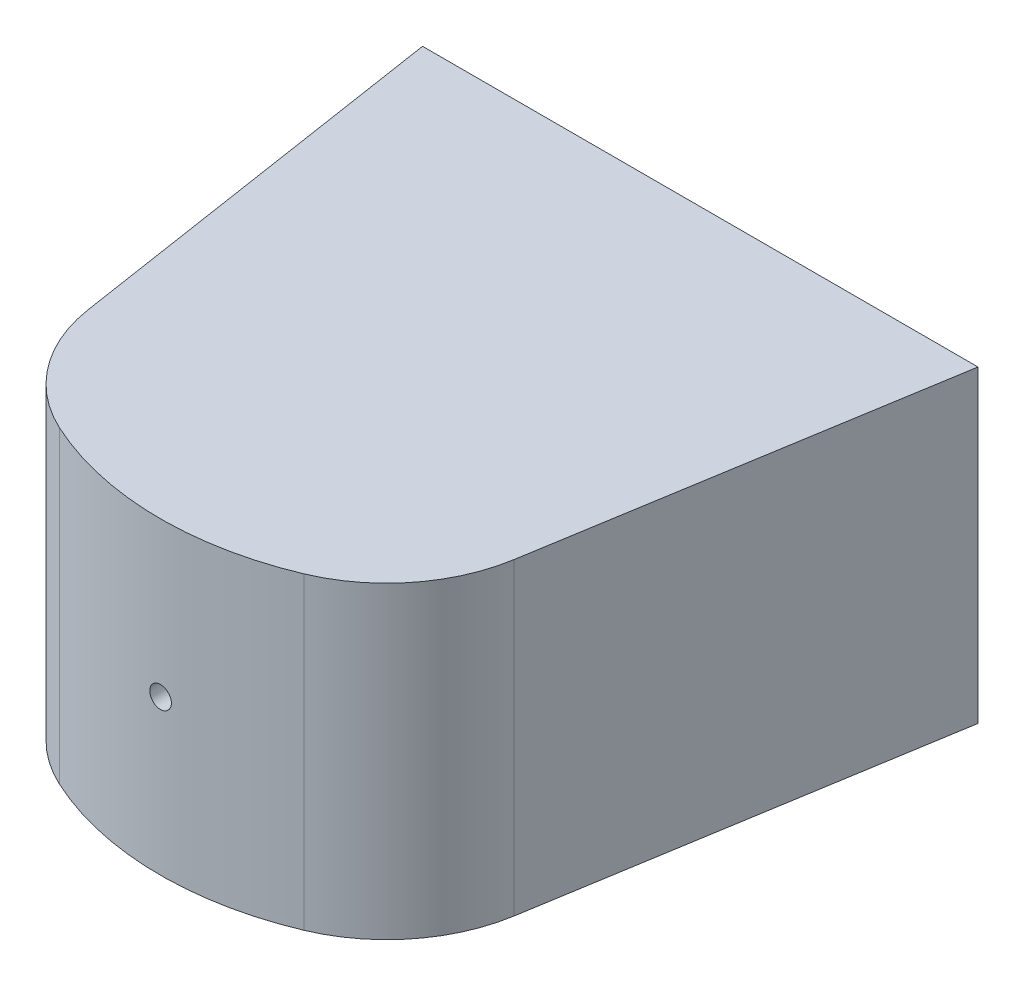
from build123d import *

# Parameters (mm, degrees)
SKETCH1_W               = 40
SKETCH1_H               = 20
BOSS_EXTRUDE1_DEPTH     = 35
FILLET1_RADIUS          = 20
FILLET1_LENGTH          = 20
CUT_EXTRUDE1_DEPTH      = 42.533119315
CUT_EXTRUDE1_DEPTH_BACK = 42.533119315
CUT_EXTRUDE2_DEPTH      = 42.533119315
CUT_EXTRUDE2_DEPTH_BACK = 42.533119315
FILLET2_R               = 10
FILLET3_R               = 10
SKETCH7_R               = 0.7
CUT_EXTRUDE3_DEPTH      = 35
SKETCH10_R              = 0.5
CUT_EXTRUDE4_DEPTH      = 5


with BuildPart() as part:
    # Sketch1 → Boss-Extrude1 (new body)
    with BuildSketch(Plane.XY):
        Rectangle(SKETCH1_W, SKETCH1_H)
    extrude(amount=BOSS_EXTRUDE1_DEPTH)

    # Fillet1: full round fillet: the end face becomes a half cylinder, R = half its width
    fillet1_face = Plane((0, 0, 35), x_dir=(0, -1, 0), z_dir=(0, 0, 1))  # on the end face: x along it, z out of the body
    fillet1_slab = fillet1_face.offset(-FILLET1_RADIUS / 2) * Box(FILLET1_LENGTH, 2 * FILLET1_RADIUS, FILLET1_RADIUS, mode=Mode.PRIVATE)  # the body's end, R deep
    fillet1_round = Plane((0, 0, 15), x_dir=(0, 0, 1), z_dir=(0, -1, 0)) * Cylinder(FILLET1_RADIUS, FILLET1_LENGTH, mode=Mode.PRIVATE)  # its axis R under the face
    add(fillet1_slab - fillet1_round, mode=Mode.SUBTRACT)

    # Sketch3 → Cut-Extrude1 (cut, two sides: drawn at the far end of the back side and taken through both)
    with BuildSketch(Plane(origin=(0, 0, 0), x_dir=(1, 0, 0), z_dir=(0, 1, 0)).offset(-CUT_EXTRUDE1_DEPTH_BACK)):
        Polygon((-12.624608069, -34.987358945), (-18.720278541, 4.574737646), (-30.971557894, -1.916976114), (-24.875887422, -41.479072706), align=None)
    extrude(amount=CUT_EXTRUDE1_DEPTH + CUT_EXTRUDE1_DEPTH_BACK, mode=Mode.SUBTRACT)

    # Sketch4 → Cut-Extrude2 (cut, two sides: drawn at the far end of the back side and taken through both)
    with BuildSketch(Plane(origin=(0, 0, 0), x_dir=(1, 0, 0), z_dir=(0, 1, 0)).offset(-CUT_EXTRUDE2_DEPTH_BACK)):
        Polygon((11.956946172, -36.772482669), (19.210484507, 7.59218203), (33.970591583, -6.999238108), (26.717053249, -51.363902807), align=None)
    extrude(amount=CUT_EXTRUDE2_DEPTH + CUT_EXTRUDE2_DEPTH_BACK, mode=Mode.SUBTRACT)

    # Fillet2
    fillet2_edges = [part.edges().sort_by_distance(p)[0] for p in [
        (13.036926478, 0, 30.167021725),
    ]]
    fillet(fillet2_edges, radius=FILLET2_R)

    # Fillet3
    fillet3_edges = [part.edges().sort_by_distance(p)[0] for p in [
        (-13.419277094, 0, 29.829801154),
    ]]
    fillet(fillet3_edges, radius=FILLET3_R)

    # Sketch7 → Cut-Extrude3 (cut)
    with BuildSketch(Plane.XY.offset(33)):
        with Locations(Location((0, 0, 0), (0, 0, 180))):
            Circle(SKETCH7_R)
    extrude(amount=CUT_EXTRUDE3_DEPTH, mode=Mode.SUBTRACT)

    # Sketch10 → Cut-Extrude4 (cut)
    with BuildSketch(Plane.XY):
        with Locations((-5, 0)):
            Circle(SKETCH10_R)
        with Locations(Location((5, 0, 0), (0, 0, 180))):
            Circle(SKETCH10_R)
    extrude(amount=CUT_EXTRUDE4_DEPTH, mode=Mode.SUBTRACT)


solid = part.part
